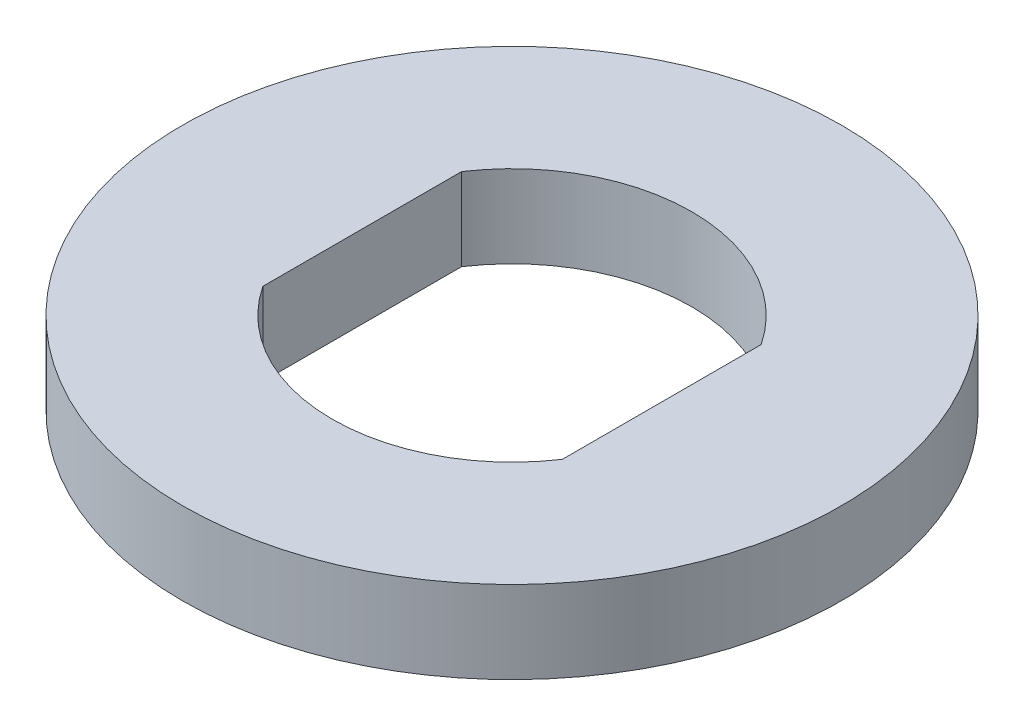
from build123d import *

# Parameters (mm, degrees)
SKETCH1_R           = 11
BOSS_EXTRUDE1_DEPTH = 1.375


with BuildPart() as part:
    # Sketch1 → Boss-Extrude1 (new, symmetric)
    with BuildSketch(Plane(origin=(0, 0, 0), x_dir=(1, 0, 0), z_dir=(0, 1, 0))):
        with Locations(Location((0, 0, 0), (0, 0, 270))):
            Circle(SKETCH1_R)
        with BuildLine():
            Line((-5, 3.31662479), (-5, -3.31662479))
            ThreePointArc((-5, -3.31662479), (0, -6), (5, -3.31662479))
            Line((5, -3.31662479), (5, 3.31662479))
            ThreePointArc((5, 3.31662479), (0, 6), (-5, 3.31662479))
        make_face(mode=Mode.SUBTRACT)
    extrude(amount=BOSS_EXTRUDE1_DEPTH, both=True)


solid = part.part
